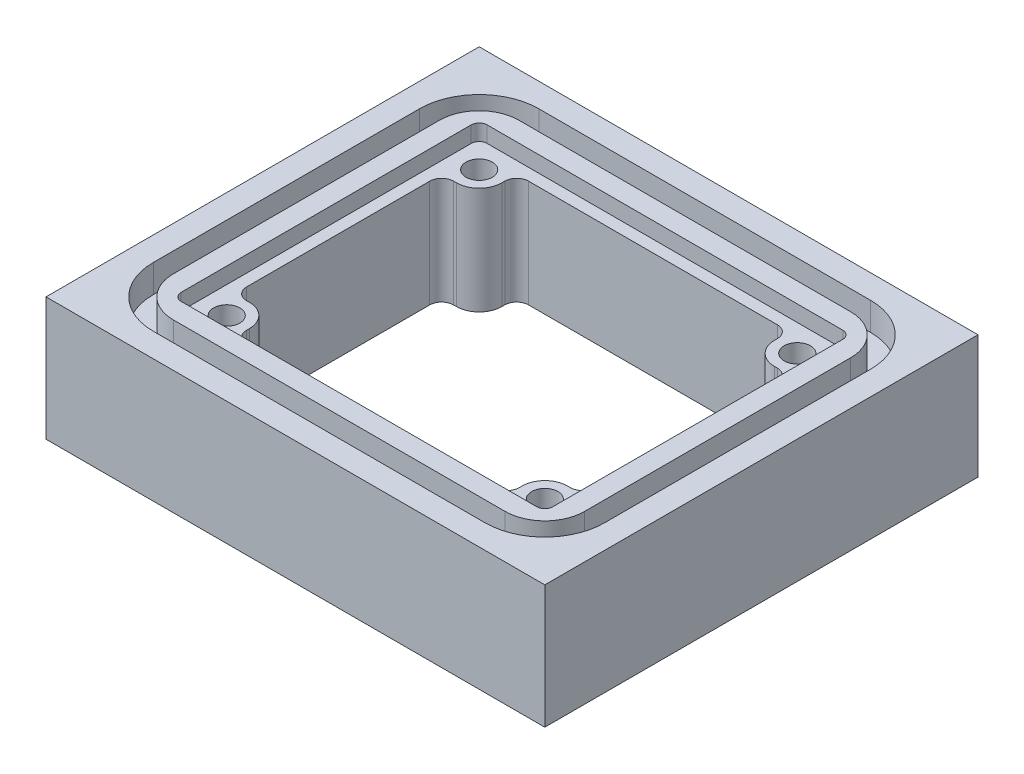
from build123d import *

# Parameters (mm, degrees)
SKETCH1_W           = 62.705
SKETCH1_H           = 54.455
SKETCH1_R           = 1.65288
BOSS_EXTRUDE1_DEPTH = 15.5
SKETCH2_W           = 46.705
SKETCH2_H           = 38.455
CUT_EXTRUDE1_DEPTH  = 2.024
FILLET2_R           = 1.5
SKETCH3_W           = 56.705
SKETCH3_H           = 48.455
SKETCH3_W_2         = 51.705
SKETCH3_H_2         = 43.455
CUT_EXTRUDE2_DEPTH  = 3.5
FILLET3_R           = 1
FILLET4_R           = 5
FILLET5_R           = 7.5


with BuildPart() as part:
    # Sketch1 → Boss-Extrude1 (new body)
    with BuildSketch(Plane(origin=(0, 0, 0), x_dir=(1, 0, 0), z_dir=(0, 1, 0))):
        Rectangle(SKETCH1_W, SKETCH1_H)
        with Locations(Location((-19.995, 15.87, 0), (0, 0, 270))):
            Circle(SKETCH1_R, mode=Mode.SUBTRACT)
        with Locations(Location((19.995, 15.87, 0), (0, 0, 90))):
            Circle(SKETCH1_R, mode=Mode.SUBTRACT)
        with Locations(Location((19.995, -15.87, 0), (0, 0, 270))):
            Circle(SKETCH1_R, mode=Mode.SUBTRACT)
        with Locations(Location((-19.995, -15.87, 0), (0, 0, 90))):
            Circle(SKETCH1_R, mode=Mode.SUBTRACT)
        with BuildLine():
            Line((21.8525, 13.0125), (21.8525, -13.0125))
            Line((21.8525, -13.0125), (19.995, -13.0125))
            ThreePointArc((19.995, -13.0125), (17.974442373, -13.849442373), (17.1375, -15.87))
            Line((17.1375, -15.87), (17.1375, -17.7275))
            Line((17.1375, -17.7275), (-17.1375, -17.7275))
            Line((-17.1375, -17.7275), (-17.1375, -15.87))
            ThreePointArc((-17.1375, -15.87), (-17.974442373, -13.849442373), (-19.995, -13.0125))
            Line((-19.995, -13.0125), (-21.8525, -13.0125))
            Line((-21.8525, -13.0125), (-21.8525, 13.0125))
            Line((-21.8525, 13.0125), (-19.995, 13.0125))
            ThreePointArc((-19.995, 13.0125), (-17.974442373, 13.849442373), (-17.1375, 15.87))
            Line((-17.1375, 15.87), (-17.1375, 17.7275))
            Line((-17.1375, 17.7275), (17.1375, 17.7275))
            Line((17.1375, 17.7275), (17.1375, 15.87))
            ThreePointArc((17.1375, 15.87), (17.974442373, 13.849442373), (19.995, 13.0125))
            Line((19.995, 13.0125), (21.8525, 13.0125))
        make_face(mode=Mode.SUBTRACT)
    extrude(amount=BOSS_EXTRUDE1_DEPTH)

    # Sketch2 → Cut-Extrude1 (cut)
    with BuildSketch(Plane(origin=(0, 15.5, 0), x_dir=(1, 0, 0), z_dir=(0, 1, 0))):
        Rectangle(SKETCH2_W, SKETCH2_H)
    extrude(amount=-CUT_EXTRUDE1_DEPTH, mode=Mode.SUBTRACT)

    # Fillet2
    fillet2_edges = [part.edges().sort_by_distance(p)[0] for p in [
        (21.8525, 6.738, -13.0125),
        (21.8525, 6.738, 13.0125),
        (17.1375, 6.738, 17.7275),
        (-17.1375, 6.738, 17.7275),
        (-21.8525, 6.738, 13.0125),
        (-21.8525, 6.738, -13.0125),
        (-17.1375, 6.738, -17.7275),
        (17.1375, 6.738, -17.7275),
    ]]
    fillet(fillet2_edges, radius=FILLET2_R)

    # Sketch3 → Cut-Extrude2 (cut)
    with BuildSketch(Plane(origin=(0, 15.5, 0), x_dir=(1, 0, 0), z_dir=(0, 1, 0))):
        Rectangle(SKETCH3_W, SKETCH3_H)
        Rectangle(SKETCH3_W_2, SKETCH3_H_2, mode=Mode.SUBTRACT)
    extrude(amount=-CUT_EXTRUDE2_DEPTH, mode=Mode.SUBTRACT)

    # Fillet3
    fillet3_edges = [part.edges().sort_by_distance(p)[0] for p in [
        (-23.3525, 14.488, 19.2275),
        (-23.3525, 14.488, -19.2275),
        (23.3525, 14.488, -19.2275),
        (23.3525, 14.488, 19.2275),
    ]]
    fillet(fillet3_edges, radius=FILLET3_R)

    # Fillet4
    fillet4_edges = [part.edges().sort_by_distance(p)[0] for p in [
        (-25.8525, 13.75, 21.7275),
        (-25.8525, 13.75, -21.7275),
        (25.8525, 13.75, -21.7275),
        (25.8525, 13.75, 21.7275),
    ]]
    fillet(fillet4_edges, radius=FILLET4_R)

    # Fillet5
    fillet5_edges = [part.edges().sort_by_distance(p)[0] for p in [
        (-28.3525, 13.75, 24.2275),
        (-28.3525, 13.75, -24.2275),
        (28.3525, 13.75, -24.2275),
        (28.3525, 13.75, 24.2275),
    ]]
    fillet(fillet5_edges, radius=FILLET5_R)


solid = part.part
